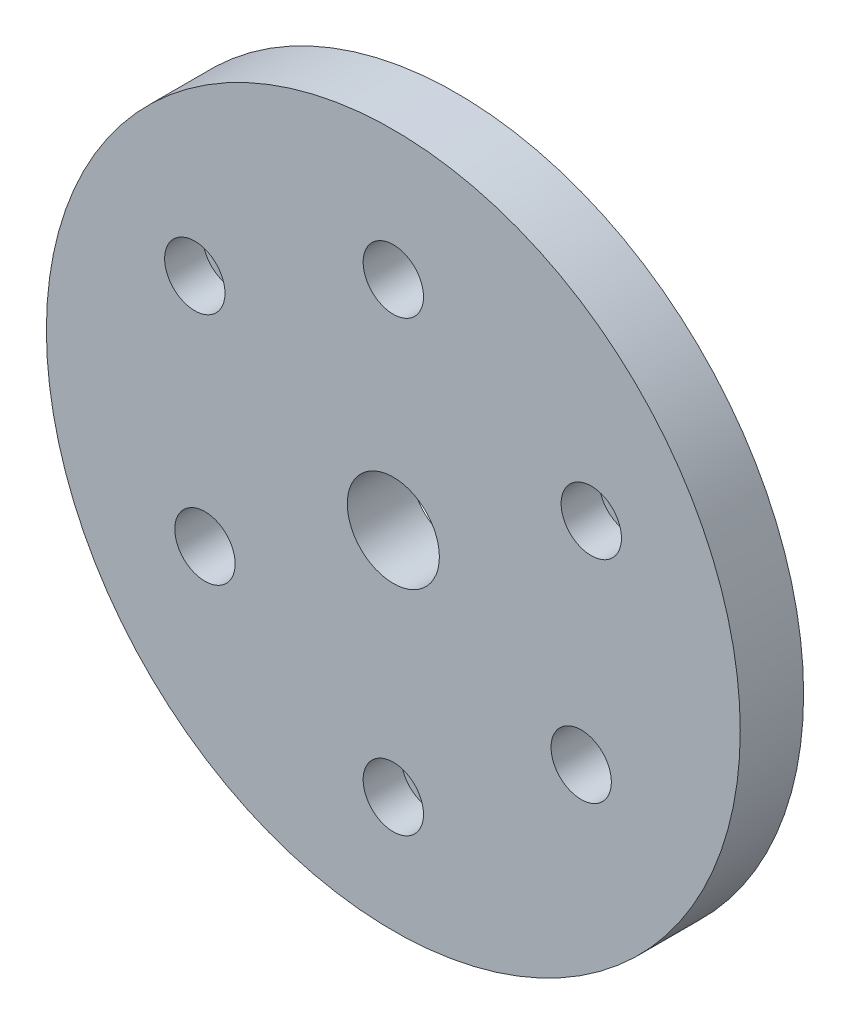
from build123d import *

# Parameters (mm, degrees)
BOSS_EXTRU_1_DEPTH                                 = 14
BOSS_EXTRU_1_DEPTH_BACK                            = 7
ESQUISSE1_R                                        = 115
ESQUISSE1_R_2                                      = 10
ESQUISSE1_R_3                                      = 15.264337522
CHAMBRAGE_POUR_VIS_T_TE_HEXAGONALE_M12_D           = 13.5
CHAMBRAGE_POUR_VIS_T_TE_HEXAGONALE_M12_DEPTH       = 20
CHAMBRAGE_POUR_VIS_T_TE_HEXAGONALE_M12_CBORE_D     = 20
CHAMBRAGE_POUR_VIS_T_TE_HEXAGONALE_M12_CBORE_DEPTH = 12.6
CHAMBRAGE_POUR_VIS_T_TE_HEXAGONALE_M12_TIP         = 4.055809178
ECHELLE1_SCALE                                     = 0.25


with BuildPart() as part:
    # Esquisse1 → Boss.-Extru.1 (new, two sides: drawn at the far end of the back side and taken through both)
    with BuildSketch(Plane.XY.offset(-BOSS_EXTRU_1_DEPTH_BACK)):
        Circle(ESQUISSE1_R)
        with Locations((0, 72)):
            Circle(ESQUISSE1_R_2, mode=Mode.SUBTRACT)
        with Locations((-62.437871739, -35.854039838)):
            Circle(ESQUISSE1_R_2, mode=Mode.SUBTRACT)
        with Locations((62.269445197, -36.145763165)):
            Circle(ESQUISSE1_R_2, mode=Mode.SUBTRACT)
        Circle(ESQUISSE1_R_3, mode=Mode.SUBTRACT)
    extrude(amount=BOSS_EXTRU_1_DEPTH + BOSS_EXTRU_1_DEPTH_BACK)

    # Chambrage pour vis à tête hexagonale M121
    with Locations(Plane.XY.offset(14)):
        with Locations((0, -76.560659085), (65.614813045, 35.516704779), (-65.803859781, 40.113875083)):
            CounterBoreHole(CHAMBRAGE_POUR_VIS_T_TE_HEXAGONALE_M12_D / 2, CHAMBRAGE_POUR_VIS_T_TE_HEXAGONALE_M12_CBORE_D / 2, CHAMBRAGE_POUR_VIS_T_TE_HEXAGONALE_M12_CBORE_DEPTH, depth=CHAMBRAGE_POUR_VIS_T_TE_HEXAGONALE_M12_DEPTH)
            with Locations((0, 0, -(CHAMBRAGE_POUR_VIS_T_TE_HEXAGONALE_M12_DEPTH + CHAMBRAGE_POUR_VIS_T_TE_HEXAGONALE_M12_TIP / 2))):  # 118° drill point
                Cone(0, CHAMBRAGE_POUR_VIS_T_TE_HEXAGONALE_M12_D / 2, CHAMBRAGE_POUR_VIS_T_TE_HEXAGONALE_M12_TIP, mode=Mode.SUBTRACT)


with BuildPart() as part_1:
    # Echelle1: scaled about (0.002531385, 0.00580145, 3.465766244)
    add(part.part.scale(ECHELLE1_SCALE).moved(Location((0.001898539, 0.004351087, 2.599324683))))


solid = part_1.part
